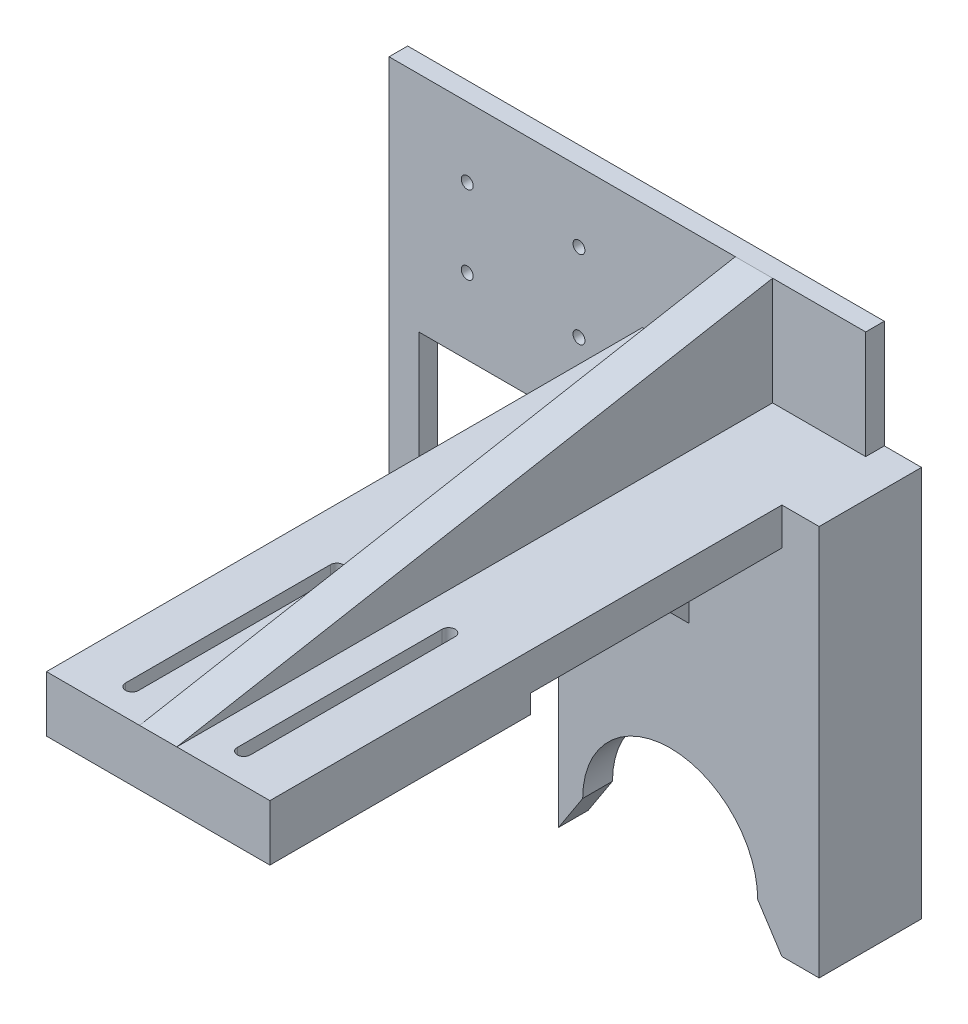
from build123d import *

# Parameters (mm, degrees)
SKETCH_1_W                   = 120
SKETCH_1_H                   = 60
EXTRUDE_1_DEPTH              = 5
SKETCH_3_W                   = 60
SKETCH_3_H                   = 8
EXTRUDE_3_DEPTH              = 60
EXTRUDE_6_DEPTH              = 10
SKETCH_11_R                  = 1.6
CUT_EXTRUDE_3_DEPTH          = 124.668912828
SKETCH_12_R                  = 1.6
CUT_EXTRUDE_4_DEPTH          = 134.603892159
SKETCH_18_R                  = 3.75
CUT_EXTRUDE_7_DEPTH          = 2
SKETCH_20_W                  = 60
SKETCH_20_H                  = 90
EXTRUDE_8_DEPTH              = 8
SKETCH_22_W                  = 60
SKETCH_22_H                  = 50
EXTRUDE_9_DEPTH              = 5
CUT_EXTRUDE_8_DEPTH          = 191.131533418
CUT_EXTRUDE_8_DEPTH_BACK     = 191.131533418
SKETCH_23_W                  = 60
SKETCH_23_H                  = 10
EXTRUDE_10_DEPTH             = 160
CUT_EXTRUDE_9_DEPTH          = 190.660222503
SKETCH_25_W                  = 150
SKETCH_25_H                  = 13
CUT_EXTRUDE_10_DEPTH         = 193.937813816
SKETCH_26_W                  = 60
SKETCH_26_H                  = 8
EXTRUDE_11_DEPTH             = 85
SKETCH_27_R                  = 23.5
CUT_EXTRUDE_11_DEPTH         = 181.364214854
EXTRUDE_12_DEPTH             = 8
SKETCH_29_W                  = 60
SKETCH_29_H                  = 70
EXTRUDE_13_DEPTH             = 5
CUT_EXTRUDE_12_DEPTH         = 207.276513447
HOLE_WIZARD_M3_1_D           = 3.2
HOLE_WIZARD_M3_1_CSINK_D     = 6.6
HOLE_WIZARD_M3_1_CSINK_ANGLE = 90
SKETCH_33_W                  = 14.5
SKETCH_33_H                  = 21
EXTRUDE_14_DEPTH             = 60
EXTRUDE_15_DEPTH             = 60
EXTRUDE_18_DEPTH             = 5
EXTRUDE_19_DEPTH             = 5
SKETCH_38_W                  = 10
SKETCH_38_H                  = 105
EXTRUDE_20_DEPTH             = 8
SKETCH_40_W                  = 10
SKETCH_40_H                  = 19.5
EXTRUDE_21_DEPTH             = 105
CUT_EXTRUDE_13_DEPTH         = 5
SKETCH_42_W                  = 8
SKETCH_42_H                  = 134
EXTRUDE_22_DEPTH             = 5
EXTRUDE_17_DEPTH             = 5


with BuildPart() as part:
    # 草图1 → 凸台-拉伸1 (new body)
    with BuildSketch(Plane.XY):
        with Locations((-25, 50)):
            Rectangle(SKETCH_1_W, SKETCH_1_H)
    extrude(amount=EXTRUDE_1_DEPTH)

    # 草图3 → 凸台-拉伸3 (add)
    with BuildSketch(Plane.XY.offset(5)):
        with Locations((5, 76)):
            Rectangle(SKETCH_3_W, SKETCH_3_H)
    extrude(amount=EXTRUDE_3_DEPTH)

    # 草图9 → 凸台-拉伸6 (add)
    with BuildSketch(Plane.XZ.offset(-20)):
        with BuildLine():
            Line((-32.5, 0), (-41.5, 0))
            Line((-41.5, 0), (-44, 0))
            Line((-44, 0), (-44, 40))
            Line((-44, 40), (-41.5, 40))
            Line((-41.5, 40), (-41.5, 35.5))
            ThreePointArc((-41.5, 35.5), (-37, 31), (-32.5, 35.5))
            Line((-32.5, 35.5), (-32.5, 40))
            Line((-32.5, 40), (-30, 40))
            Line((-30, 40), (-30, 0))
            Line((-30, 0), (-32.5, 0))
        make_face()
    extrude(amount=EXTRUDE_6_DEPTH)

    # 草图11 → 切除-拉伸3 (cut, through all)
    with BuildSketch(Plane(origin=(0, 72, 0), x_dir=(-1, 0, 0), z_dir=(0, -1, 0))):
        with Locations(Location((-20, -52.088110118, 0), (0, 0, 90))):
            Circle(SKETCH_11_R)
        with Locations(Location((10, -28.088110118, 0), (0, 0, 90))):
            Circle(SKETCH_11_R)
        with Locations(Location((-20, -28.088110118, 0), (0, 0, 90))):
            Circle(SKETCH_11_R)
        with Locations(Location((10, -52.088110118, 0), (0, 0, 90))):
            Circle(SKETCH_11_R)
    extrude(amount=-CUT_EXTRUDE_3_DEPTH, mode=Mode.SUBTRACT)

    # 草图12 → 切除-拉伸4 (cut, through all)
    with BuildSketch(Plane(origin=(0, 0, 0), x_dir=(-1, 0, 0), z_dir=(0, 0, -1))):
        with Locations((42, 40.25)):
            Circle(SKETCH_12_R)
        with Locations((42, 61.25)):
            Circle(SKETCH_12_R)
        with Locations((72, 40.25)):
            Circle(SKETCH_12_R)
        with Locations((72, 61.25)):
            Circle(SKETCH_12_R)
    extrude(amount=-CUT_EXTRUDE_4_DEPTH, mode=Mode.SUBTRACT)

    # 草图18 → 切除-拉伸7 (cut)
    with BuildSketch(Plane(origin=(0, 0, 0), x_dir=(-1, 0, 0), z_dir=(0, 0, -1))):
        with Locations((75, 75)):
            Circle(SKETCH_18_R)
        with Locations((25, 75)):
            Circle(SKETCH_18_R)
        with Locations((-25, 75)):
            Circle(SKETCH_18_R)
        with Locations((-25, 25)):
            Circle(SKETCH_18_R)
        with Locations((25, 25)):
            Circle(SKETCH_18_R)
        with Locations((75, 25)):
            Circle(SKETCH_18_R)
    extrude(amount=-CUT_EXTRUDE_7_DEPTH, mode=Mode.SUBTRACT)

    # 草图20 → 凸台-拉伸8 (add)
    with BuildSketch(Plane(origin=(0, 80, 0), x_dir=(1, 0, 0), z_dir=(0, 1, 0))):
        with Locations((5, -110)):
            Rectangle(SKETCH_20_W, SKETCH_20_H)
    extrude(amount=-EXTRUDE_8_DEPTH)

    # 草图22 → 凸台-拉伸9 (add)
    with BuildSketch(Plane.XZ.offset(-72)):
        with Locations((5, 130)):
            Rectangle(SKETCH_22_W, SKETCH_22_H)
    extrude(amount=EXTRUDE_9_DEPTH)

    # 草图21 → 切除-拉伸8 (cut, two sides: drawn at the far end of the back side and taken through both)
    with BuildSketch(Plane(origin=(0, 80, 0), x_dir=(1, 0, 0), z_dir=(0, 1, 0)).offset(-CUT_EXTRUDE_8_DEPTH_BACK)):
        with BuildLine():
            Line((21.75, -115), (21.75, -145))
            ThreePointArc((21.75, -145), (20, -146.75), (18.25, -145))
            Line((18.25, -145), (18.25, -115))
            ThreePointArc((18.25, -115), (20, -113.25), (21.75, -115))
        make_face()
        with BuildLine():
            Line((-11.75, -115), (-11.75, -145))
            ThreePointArc((-11.75, -145), (-10, -146.75), (-8.25, -145))
            Line((-8.25, -145), (-8.25, -115))
            ThreePointArc((-8.25, -115), (-10, -113.25), (-11.75, -115))
        make_face()
    extrude(amount=CUT_EXTRUDE_8_DEPTH + CUT_EXTRUDE_8_DEPTH_BACK, mode=Mode.SUBTRACT)

    # 草图23 → 凸台-拉伸10 (add)
    with BuildSketch(Plane.XY.offset(5)):
        with Locations((5, 46)):
            Rectangle(SKETCH_23_W, SKETCH_23_H)
    extrude(amount=EXTRUDE_10_DEPTH)

    # 草图24 → 切除-拉伸9 (cut, through all)
    with BuildSketch(Plane.XZ.offset(-41)):
        with BuildLine():
            Line((-8.25, 157), (-8.25, 102))
            ThreePointArc((-8.25, 102), (-10, 100.25), (-11.75, 102))
            Line((-11.75, 102), (-11.75, 157))
            ThreePointArc((-11.75, 157), (-10, 158.75), (-8.25, 157))
        make_face()
        with BuildLine():
            Line((18.25, 157), (18.25, 102))
            ThreePointArc((18.25, 102), (20, 100.25), (21.75, 102))
            Line((21.75, 102), (21.75, 157))
            ThreePointArc((21.75, 157), (20, 158.75), (18.25, 157))
        make_face()
    extrude(amount=-CUT_EXTRUDE_9_DEPTH, mode=Mode.SUBTRACT)

    # 草图25 → 切除-拉伸10 (cut, through all)
    with BuildSketch(Plane.ZY.offset(25)):
        with Locations((80, 73.5)):
            Rectangle(SKETCH_25_W, SKETCH_25_H)
    extrude(amount=-CUT_EXTRUDE_10_DEPTH, mode=Mode.SUBTRACT)

    # 草图26 → 凸台-拉伸11 (add)
    with BuildSketch(Plane.XZ.offset(-41)):
        with Locations((5, 23.5)):
            Rectangle(SKETCH_26_W, SKETCH_26_H)
    extrude(amount=EXTRUDE_11_DEPTH)

    # 草图27 → 切除-拉伸11 (cut, through all)
    with BuildSketch(Plane.XY.offset(27.5)):
        with Locations((5, -44)):
            Circle(SKETCH_27_R)
    extrude(amount=-CUT_EXTRUDE_11_DEPTH, mode=Mode.SUBTRACT)

    # 草图28 → 凸台-拉伸12 (add)
    with BuildSketch(Plane.XY.offset(27.5)):
        Polygon((35, -44), (35, -54), (28.5, -44), align=None)
        Polygon((-25, -44), (-25, -54), (-18.5, -44), align=None)
    extrude(amount=-EXTRUDE_12_DEPTH)

    # 草图29 → 凸台-拉伸13 (add)
    with BuildSketch(Plane.XZ.offset(-41)):
        with Locations((5, 130)):
            Rectangle(SKETCH_29_W, SKETCH_29_H)
    extrude(amount=EXTRUDE_13_DEPTH)

    # 草图30 → 切除-拉伸12 (cut, through all)
    with BuildSketch(Plane.XZ.offset(-36)):
        with BuildLine():
            Line((18.25, 102), (18.25, 157))
            ThreePointArc((18.25, 157), (20, 158.75), (21.75, 157))
            Line((21.75, 157), (21.75, 102))
            ThreePointArc((21.75, 102), (20, 100.25), (18.25, 102))
        make_face()
        with BuildLine():
            Line((-8.25, 102), (-8.25, 157))
            ThreePointArc((-8.25, 157), (-10, 158.75), (-11.75, 157))
            Line((-11.75, 157), (-11.75, 102))
            ThreePointArc((-11.75, 102), (-10, 100.25), (-8.25, 102))
        make_face()
    extrude(amount=-CUT_EXTRUDE_12_DEPTH, mode=Mode.SUBTRACT)

    # M3 十字槽沉头木螺钉的锥形沉头孔1 (through all)
    with Locations(Plane(origin=(0, 0, 0), x_dir=(-1, 0, 0), z_dir=(0, 0, -1))):
        with Locations((42, 61.25), (72, 61.25), (72, 40.25), (42, 40.25)):
            CounterSinkHole(HOLE_WIZARD_M3_1_D / 2, HOLE_WIZARD_M3_1_CSINK_D / 2, counter_sink_angle=HOLE_WIZARD_M3_1_CSINK_ANGLE)

    # 草图33 → 凸台-拉伸14 (add)
    with BuildSketch(Plane(origin=(35, 0, 0), x_dir=(0, 0, -1), z_dir=(1, 0, 0))):
        with Locations((-12.25, 30.5)):
            Rectangle(SKETCH_33_W, SKETCH_33_H)
    extrude(amount=-EXTRUDE_14_DEPTH)

    # 草图34 → 凸台-拉伸15 (add)
    with BuildSketch(Plane(origin=(35, 0, 0), x_dir=(0, 0, -1), z_dir=(1, 0, 0))):
        Polygon((-19.5, 10), (0, 20), (-19.5, 20), align=None)
    extrude(amount=-EXTRUDE_15_DEPTH)

    # 草图35 → 凸台-拉伸18 (add, symmetric)
    with BuildSketch(Plane(origin=(5, 0, 0), x_dir=(0, 0, -1), z_dir=(1, 0, 0))):
        Polygon((-57.5, 41), (-27.5, 11), (-27.5, 41), align=None)
    extrude(amount=EXTRUDE_18_DEPTH, both=True)

    # 草图37 → 凸台-拉伸19 (add, symmetric)
    with BuildSketch(Plane(origin=(5, 0, 0), x_dir=(0, 0, -1), z_dir=(1, 0, 0))):
        Polygon((-5, 80), (-165, 51), (-5, 51), align=None)
    extrude(amount=EXTRUDE_19_DEPTH, both=True)

    # 草图38 → 凸台-拉伸20 (add)
    with BuildSketch(Plane.XY.offset(27.5)):
        with Locations((40, -1.5)):
            Rectangle(SKETCH_38_W, SKETCH_38_H)
    extrude(amount=-EXTRUDE_20_DEPTH)

    # 草图40 → 凸台-拉伸21 (add)
    with BuildSketch(Plane.XZ.offset(54)):
        with Locations((40, 9.75)):
            Rectangle(SKETCH_40_W, SKETCH_40_H)
    extrude(amount=-EXTRUDE_21_DEPTH)

    # 草图41 → 切除-拉伸13 (cut)
    with BuildSketch(Plane.ZY.offset(-35)):
        Polygon((0, 20), (19.5, 10), (19.5, -54), (0, -54), align=None)
    extrude(amount=-CUT_EXTRUDE_13_DEPTH, mode=Mode.SUBTRACT)

    # 草图42 → 凸台-拉伸22 (add)
    with BuildSketch(Plane.XY.offset(5)):
        with Locations((-89, 13)):
            Rectangle(SKETCH_42_W, SKETCH_42_H)
    extrude(amount=-EXTRUDE_22_DEPTH)

    # 草图36 → 凸台-拉伸17 (add, symmetric)
    with BuildSketch(Plane(origin=(5, 0, 0), x_dir=(0, 0, -1), z_dir=(1, 0, 0))):
        Polygon((-5, 80), (-165, 51), (-5, 51), align=None)
    extrude(amount=EXTRUDE_17_DEPTH, both=True)


solid = part.part
